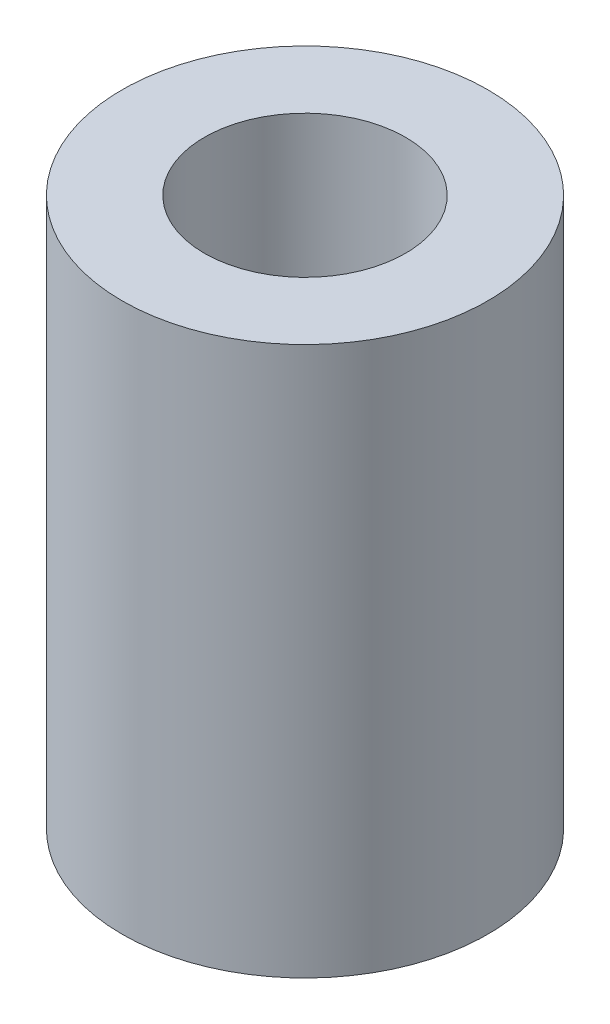
from build123d import *

# Parameters (mm, degrees)
SKETCH1_R           = 3
SKETCH1_R_2         = 1.65
BOSS_EXTRUDE1_DEPTH = 9


with BuildPart() as part:
    # Sketch1 → Boss-Extrude1 (new body)
    with BuildSketch(Plane(origin=(0, 0, 0), x_dir=(1, 0, 0), z_dir=(0, 1, 0))):
        with Locations(Location((0, 0, 0), (0, 0, 270))):
            Circle(SKETCH1_R)
        with Locations(Location((0, 0, 0), (0, 0, 270))):
            Circle(SKETCH1_R_2, mode=Mode.SUBTRACT)
    extrude(amount=BOSS_EXTRUDE1_DEPTH)


solid = part.part
